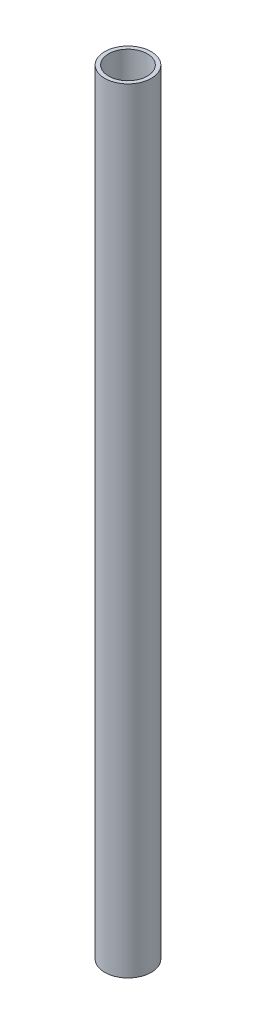
from build123d import *

# Parameters (mm, degrees)
SKETCH_1_R      = 6
SKETCH_1_R_2    = 5
EXTRUDE_1_DEPTH = 200


with BuildPart() as part:
    # 草图1 → 凸台-拉伸1 (new body)
    with BuildSketch(Plane(origin=(0, 0, 0), x_dir=(1, 0, 0), z_dir=(0, 1, 0))):
        with Locations(Location((0, 0, 0), (0, 0, 270))):
            Circle(SKETCH_1_R)
        with Locations(Location((0, 0, 0), (0, 0, 270))):
            Circle(SKETCH_1_R_2, mode=Mode.SUBTRACT)
    extrude(amount=EXTRUDE_1_DEPTH)


solid = part.part
